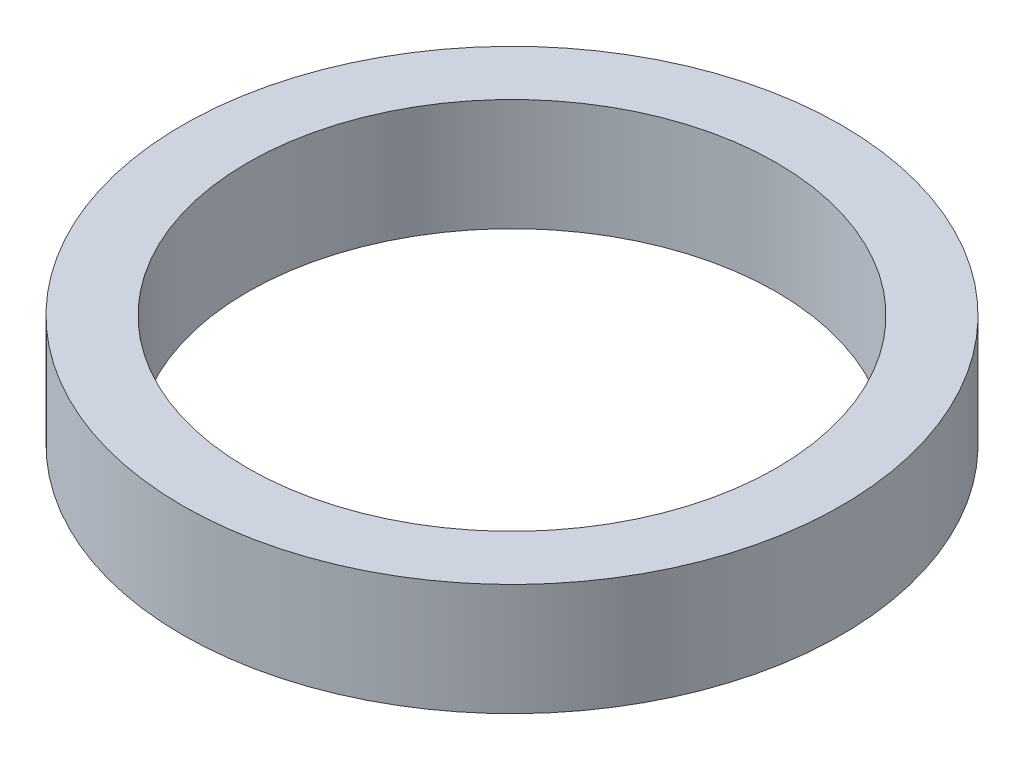
from build123d import *

# Parameters (mm, degrees)
SKETCH1_R           = 16.2
SKETCH1_R_2         = 13
BOSS_EXTRUDE1_DEPTH = 5.5


with BuildPart() as part:
    # Sketch1 → Boss-Extrude1 (new body)
    with BuildSketch(Plane(origin=(0, 0, 0), x_dir=(1, 0, 0), z_dir=(0, 1, 0))):
        with Locations(Location((0, 0, 0), (0, 0, 270))):
            Circle(SKETCH1_R)
        with Locations(Location((0, 0, 0), (0, 0, 270))):
            Circle(SKETCH1_R_2, mode=Mode.SUBTRACT)
    extrude(amount=BOSS_EXTRUDE1_DEPTH)


solid = part.part
